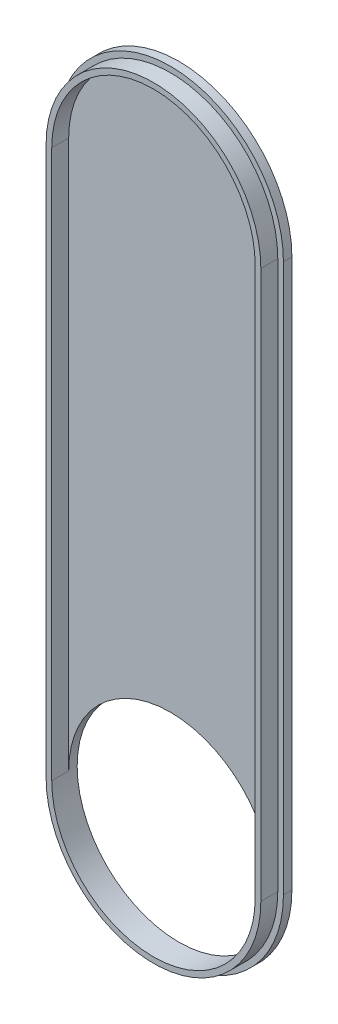
from build123d import *

# Parameters (mm, degrees)
BOSS_EXTRUDE1_DEPTH = 1.5
BOSS_EXTRUDE2_DEPTH = 3
SKETCH6_R           = 18
CUT_EXTRUDE1_DEPTH  = 119.782364011


with BuildPart() as part:
    # Sketch3 → Boss-Extrude1 (new body)
    with BuildSketch(Plane.XY):
        with BuildLine():
            Line((-20, 0), (-20, -97))
            ThreePointArc((-20, -97), (0, -117), (20, -97))
            Line((20, -97), (20, 0))
            ThreePointArc((20, 0), (0, 20), (-20, 0))
        make_face()
    extrude(amount=BOSS_EXTRUDE1_DEPTH)

    # Sketch5 → Boss-Extrude2 (add)
    with BuildSketch(Plane.XY.offset(1.5)):
        with BuildLine():
            Line((-19, 0), (-19, -97))
            ThreePointArc((-19, -97), (0, -116), (19, -97))
            Line((19, -97), (19, 0))
            ThreePointArc((19, 0), (0, 19), (-19, 0))
        make_face()
        with BuildLine():
            Line((-18, 0), (-18, -97))
            ThreePointArc((-18, -97), (0, -115), (18, -97))
            Line((18, -97), (18, 0))
            ThreePointArc((18, 0), (0, 18), (-18, 0))
        make_face(mode=Mode.SUBTRACT)
    extrude(amount=BOSS_EXTRUDE2_DEPTH)

    # Sketch6 → Cut-Extrude1 (cut, through all)
    with BuildSketch(Plane(origin=(0, 0, 0), x_dir=(-1, 0, 0), z_dir=(0, 0, -1))):
        with Locations((0, -97)):
            Circle(SKETCH6_R)
    extrude(amount=-CUT_EXTRUDE1_DEPTH, mode=Mode.SUBTRACT)


solid = part.part
